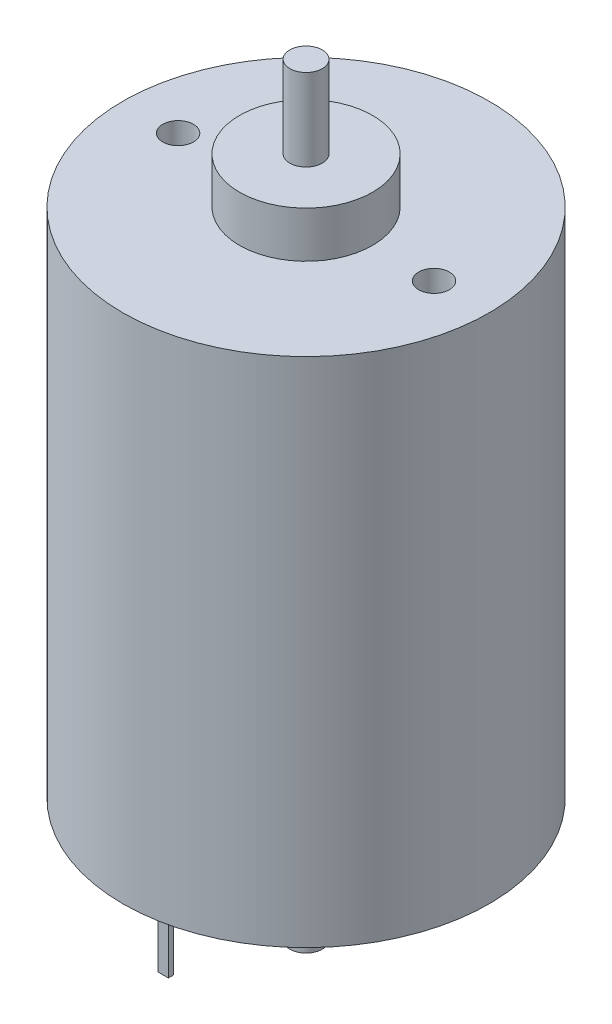
from build123d import *

# Parameters (mm, degrees)
SKETCH1_R           = 17.9
BOSS_EXTRUDE1_DEPTH = 50
SKETCH2_R           = 6.5
BOSS_EXTRUDE2_DEPTH = 4.5
SKETCH3_R           = 1.585
BOSS_EXTRUDE3_DEPTH = 12.5
SKETCH4_R           = 5.1
BOSS_EXTRUDE4_DEPTH = 3
BOSS_EXTRUDE5_START = 12.5
SKETCH5_R           = 1.585
BOSS_EXTRUDE5_DEPTH = 12.5
BOSS_EXTRUDE6_DEPTH = 8
SKETCH7_R           = 1.5
CUT_EXTRUDE1_DEPTH  = 8
CUT_EXTRUDE2_START  = -4.5
SKETCH8_R           = 1.585
CUT_EXTRUDE2_DEPTH  = 4.5
SKETCH9_R           = 1.585
CUT_EXTRUDE3_DEPTH  = 3.5


with BuildPart() as part:
    # Sketch1 → Boss-Extrude1 (new body)
    with BuildSketch(Plane(origin=(0, 0, 0), x_dir=(1, 0, 0), z_dir=(0, 1, 0))):
        with Locations(Location((0, 0, 0), (0, 0, 270))):
            Circle(SKETCH1_R)
    extrude(amount=BOSS_EXTRUDE1_DEPTH)

    # Sketch2 → Boss-Extrude2 (add)
    with BuildSketch(Plane(origin=(0, 50, 0), x_dir=(1, 0, 0), z_dir=(0, 1, 0))):
        with Locations(Location((0, 0, 0), (0, 0, 270))):
            Circle(SKETCH2_R)
    extrude(amount=BOSS_EXTRUDE2_DEPTH)

    # Sketch3 → Boss-Extrude3 (add)
    with BuildSketch(Plane(origin=(0, 54.5, 0), x_dir=(1, 0, 0), z_dir=(0, 1, 0))):
        with Locations(Location((0, 0, 0), (0, 0, 270))):
            Circle(SKETCH3_R)
    extrude(amount=BOSS_EXTRUDE3_DEPTH)

    # Sketch4 → Boss-Extrude4 (add)
    with BuildSketch(Plane.XZ):
        with Locations(Location((0, 0, 0), (0, 0, 90))):
            Circle(SKETCH4_R)
    extrude(amount=BOSS_EXTRUDE4_DEPTH)

    # Sketch5 → Boss-Extrude5 (add)
    with BuildSketch(Plane(origin=(0, -3, 0), x_dir=(-1, 0, 0), z_dir=(0, -1, 0)).offset(BOSS_EXTRUDE5_START)):
        with Locations(Location((0, 0, 0), (0, 0, 270))):
            Circle(SKETCH5_R)
    extrude(amount=-BOSS_EXTRUDE5_DEPTH)

    # Sketch6 → Boss-Extrude6 (add)
    with BuildSketch(Plane.XZ):
        Polygon((0, -13.95), (0, -13.7), (0, -13.45), (-0.5, -13.45), (-0.5, -13.95), align=None)
        Polygon((0, -13.45), (0, -13.7), (0, -13.95), (0.5, -13.95), (0.5, -13.45), align=None)
        Polygon((0, 13.45), (0, 13.7), (0, 13.95), (-0.5, 13.95), (-0.5, 13.45), align=None)
        Polygon((0, 13.95), (0, 13.7), (0, 13.45), (0.5, 13.45), (0.5, 13.95), align=None)
    extrude(amount=BOSS_EXTRUDE6_DEPTH)

    # Sketch7 → Cut-Extrude1 (cut)
    with BuildSketch(Plane(origin=(0, 50, 0), x_dir=(1, 0, 0), z_dir=(0, 1, 0))):
        with Locations(Location((12.5, 0, 0), (0, 0, 270))):
            Circle(SKETCH7_R)
        with Locations(Location((-12.5, 0, 0), (0, 0, 270))):
            Circle(SKETCH7_R)
    extrude(amount=-CUT_EXTRUDE1_DEPTH, mode=Mode.SUBTRACT)

    # Sketch8 → Cut-Extrude2 (cut)
    with BuildSketch(Plane(origin=(0, 67, 0), x_dir=(1, 0, 0), z_dir=(0, 1, 0)).offset(CUT_EXTRUDE2_START)):
        with Locations(Location((0, 0, 0), (0, 0, 270))):
            Circle(SKETCH8_R)
    extrude(amount=CUT_EXTRUDE2_DEPTH, mode=Mode.SUBTRACT)

    # Sketch9 → Cut-Extrude3 (cut)
    with BuildSketch(Plane.XZ.offset(15.5)):
        with Locations(Location((0, 0, 0), (0, 0, 270))):
            Circle(SKETCH9_R)
    extrude(amount=-CUT_EXTRUDE3_DEPTH, mode=Mode.SUBTRACT)


solid = part.part
